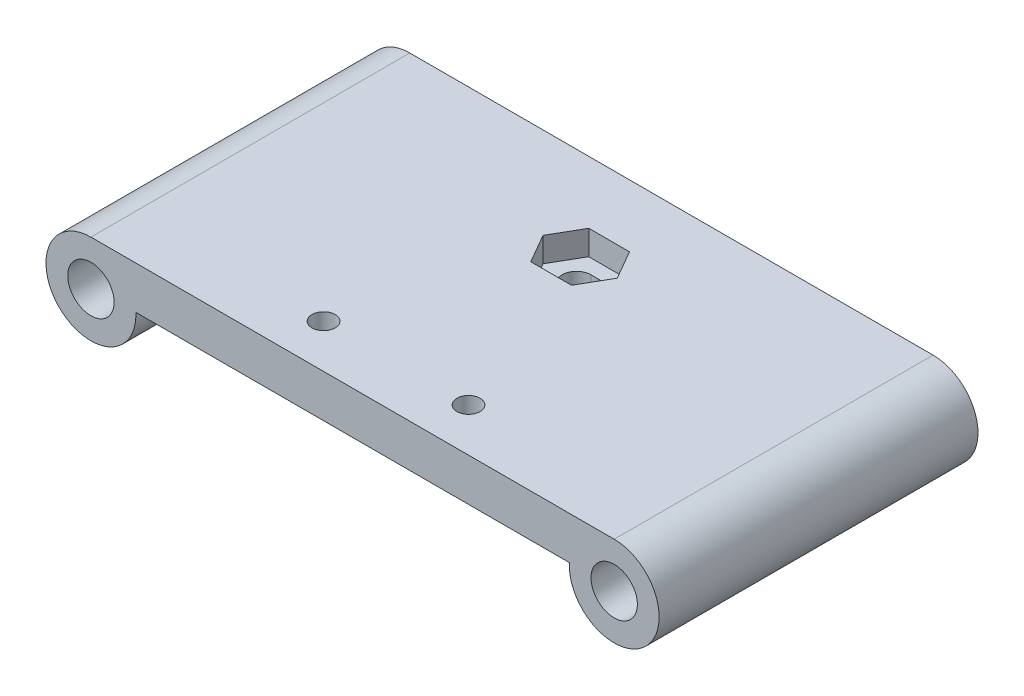
from build123d import *

# Parameters (mm, degrees)
SKETCH_3_R          = 3.1
SKETCH_3_R_2        = 1.6
EXTRUDE_1_DEPTH     = 22
CUT_EXTRUDE_1_REACH = 32.691
CUT_EXTRUDE_2_DEPTH = 1.7
CUT_EXTRUDE_3_REACH = 33.141
SKETCH_6_R          = 0.8
SKETCH_7_R          = 1.4
CUT_EXTRUDE_4_DEPTH = 0.5


with BuildPart() as part:
    # 草图3 → 凸台-拉伸1 (new body)
    # profile 1 of 3: a face of its own
    with BuildSketch(Plane.XY):
        with Locations((18.05, -11.455)):
            Circle(SKETCH_3_R)
        with Locations((18.05, -11.455)):
            Circle(SKETCH_3_R_2, mode=Mode.SUBTRACT)
    # profile 2 of 3: a face of its own
    with BuildSketch(Plane.XY):
        with BuildLine():
            Line((18.05, -8.355), (-18.05, -8.355))
            ThreePointArc((-18.05, -8.355), (-15.913472443, -9.208836604), (-14.953877425, -11.3))
            Line((-14.953877425, -11.3), (14.953877425, -11.3))
            ThreePointArc((14.953877425, -11.3), (15.913472443, -9.208836604), (18.05, -8.355))
        make_face()
    # profile 3 of 3: a face of its own
    with BuildSketch(Plane.XY):
        with Locations((-18.05, -11.455)):
            Circle(SKETCH_3_R)
        with Locations((-18.05, -11.455)):
            Circle(SKETCH_3_R_2, mode=Mode.SUBTRACT)
    extrude(amount=-EXTRUDE_1_DEPTH)

    # 草图4 → 切除-拉伸1 (cut, up to next)
    with BuildSketch(Plane.XZ.offset(11.3), mode=Mode.PRIVATE) as cut_extrude_1_sk1:
        with BuildLine():
            Line((-0.25, -14.7), (0.25, -14.7))
            ThreePointArc((0.25, -14.7), (1.25, -15.7), (0.25, -16.7))
            Line((0.25, -16.7), (-0.25, -16.7))
            ThreePointArc((-0.25, -16.7), (-1.25, -15.7), (-0.25, -14.7))
        make_face()
    cut_extrude_1_tool1 = extrude(cut_extrude_1_sk1.sketch, amount=-CUT_EXTRUDE_1_REACH, mode=Mode.PRIVATE) & part.part
    add(cut_extrude_1_tool1.solids().sort_by_distance((0, -11.3, -15.7))[0], mode=Mode.SUBTRACT)

    # 草图5 → 切除-拉伸2 (cut)
    with BuildSketch(Plane(origin=(0, -8.355, 0), x_dir=(1, 0, 0), z_dir=(0, 1, 0))):
        Polygon((2.059401077, 15.7), (0.904700538, 17.7), (-1.404700538, 17.7), (-2.559401077, 15.7), (-1.404700538, 13.7), (0.904700538, 13.7), align=None)
        Polygon((2.559401077, 15.7), (1.404700538, 17.7), (-0.904700538, 17.7), (-2.059401077, 15.7), (-0.904700538, 13.7), (1.404700538, 13.7), align=None)
    extrude(amount=-CUT_EXTRUDE_2_DEPTH, mode=Mode.SUBTRACT)

    # 草图6 → 切除-拉伸3 (cut, up to next)
    with BuildSketch(Plane(origin=(0, -8.355, 0), x_dir=(1, 0, 0), z_dir=(0, 1, 0)), mode=Mode.PRIVATE) as cut_extrude_3_sk1:
        with Locations(Location((-5, 3, 0), (0, 0, 180))):
            Circle(SKETCH_6_R)
    cut_extrude_3_tool1 = extrude(cut_extrude_3_sk1.sketch, amount=-CUT_EXTRUDE_3_REACH, mode=Mode.PRIVATE) & part.part
    # 草图6 → 切除-拉伸3 (cut, up to next)
    with BuildSketch(Plane(origin=(0, -8.355, 0), x_dir=(1, 0, 0), z_dir=(0, 1, 0)), mode=Mode.PRIVATE) as cut_extrude_3_sk2:
        with Locations(Location((5, 3, 0), (0, 0, 180))):
            Circle(SKETCH_6_R)
    cut_extrude_3_tool2 = extrude(cut_extrude_3_sk2.sketch, amount=-CUT_EXTRUDE_3_REACH, mode=Mode.PRIVATE) & part.part
    add(cut_extrude_3_tool1.solids().sort_by_distance((-5, -8.355, -3))[0], mode=Mode.SUBTRACT)
    add(cut_extrude_3_tool2.solids().sort_by_distance((5, -8.355, -3))[0], mode=Mode.SUBTRACT)

    # 草图7 → 切除-拉伸4 (cut)
    with BuildSketch(Plane.XZ.offset(11.3)):
        with Locations(Location((5, -3, 0), (0, 0, 270))):
            Circle(SKETCH_7_R)
        with Locations(Location((-5, -3, 0), (0, 0, 270))):
            Circle(SKETCH_7_R)
    extrude(amount=-CUT_EXTRUDE_4_DEPTH, mode=Mode.SUBTRACT)


solid = part.part
